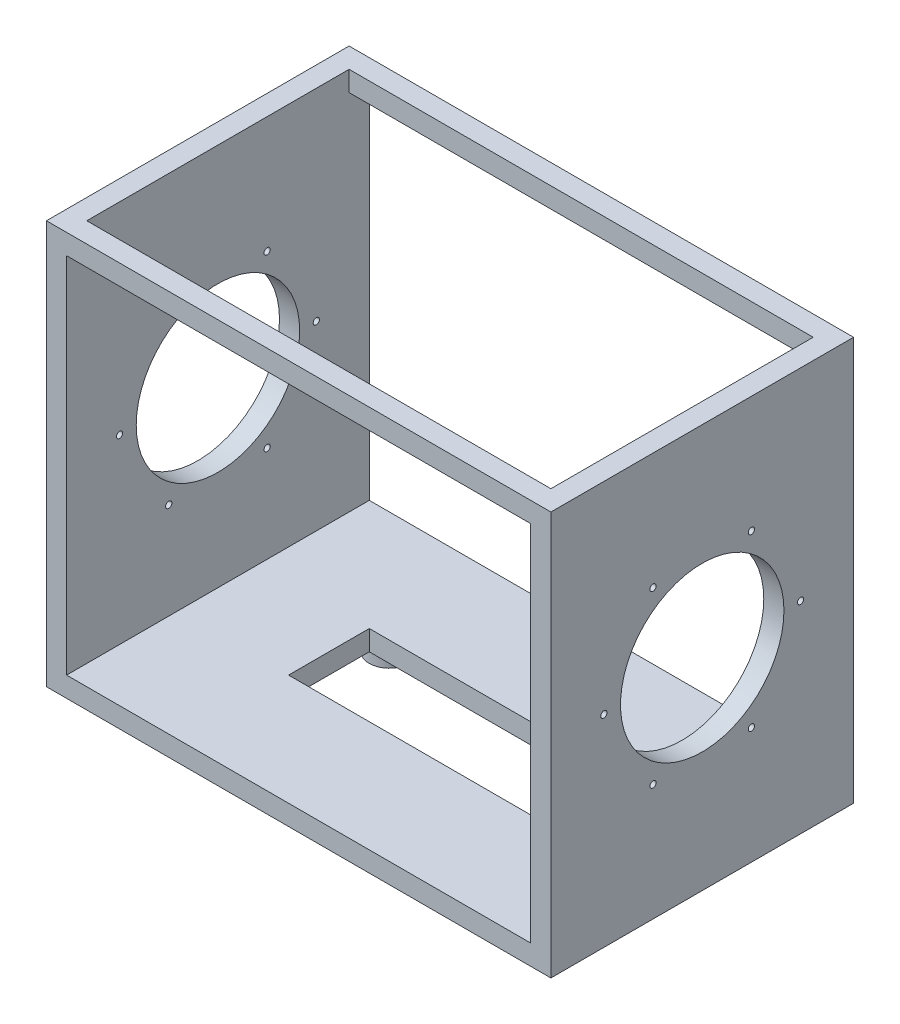
from build123d import *

# Parameters (mm, degrees)
SKETCH_1_W          = 250
SKETCH_1_H          = 150
EXTRUDE_2_DEPTH     = 200
SKETCH_3_W          = 230
SKETCH_3_H          = 130
CUT_EXTRUDE_1_DEPTH = 190
SKETCH_4_W          = 230
SKETCH_4_H          = 180
CUT_EXTRUDE_2_DEPTH = 190
SKETCH_5_R          = 40.5
SKETCH_5_R_2        = 1.55
CUT_EXTRUDE_3_DEPTH = 250
SKETCH_14_W         = 120
SKETCH_14_H         = 40
CUT_EXTRUDE_4_DEPTH = 20


with BuildPart() as part:
    # 草图1 → 凸台-拉伸2 (new body)
    with BuildSketch(Plane(origin=(0, 0, 0), x_dir=(1, 0, 0), z_dir=(0, 1, 0))):
        Rectangle(SKETCH_1_W, SKETCH_1_H)
    extrude(amount=EXTRUDE_2_DEPTH)

    # 草图3 → 切除-拉伸1 (cut)
    with BuildSketch(Plane(origin=(0, 200, 0), x_dir=(1, 0, 0), z_dir=(0, 1, 0))):
        Rectangle(SKETCH_3_W, SKETCH_3_H)
    extrude(amount=-CUT_EXTRUDE_1_DEPTH, mode=Mode.SUBTRACT)

    # 草图4 → 切除-拉伸2 (cut)
    with BuildSketch(Plane.XY.offset(75)):
        with Locations((0, 100)):
            Rectangle(SKETCH_4_W, SKETCH_4_H)
    extrude(amount=-CUT_EXTRUDE_2_DEPTH, mode=Mode.SUBTRACT)

    # 草图5 → 切除-拉伸3 (cut)
    with BuildSketch(Plane(origin=(125, 0, 0), x_dir=(0, 0, -1), z_dir=(1, 0, 0))):
        with Locations((0, 100)):
            Circle(SKETCH_5_R)
        with Locations((-24.375, 142.218738434)):
            Circle(SKETCH_5_R_2)
        with Locations((-48.75, 100)):
            Circle(SKETCH_5_R_2)
        with Locations((24.375, 142.218738434)):
            Circle(SKETCH_5_R_2)
        with Locations((48.75, 100)):
            Circle(SKETCH_5_R_2)
        with Locations((24.375, 57.781261566)):
            Circle(SKETCH_5_R_2)
        with Locations((-24.375, 57.781261566)):
            Circle(SKETCH_5_R_2)
    extrude(amount=-CUT_EXTRUDE_3_DEPTH, mode=Mode.SUBTRACT)

    # 草图10 → 旋转2 (revolve)
    with BuildSketch(Plane.XY.offset(45), mode=Mode.PRIVATE) as revolve_2_sk:
        Polygon((-75, 0), (-75, -20), (-85, -20), (-85, -10), (-95, 0), (-85, 0), align=None)
    revolve(revolve_2_sk.sketch.rotate(Axis((-75, 0, 45), (0, -1, 0)), 270), axis=Axis((-75, 0, 45), (0, -1, 0)))

    # 草图11 → 旋转4 (revolve)
    with BuildSketch(Plane.XY.offset(45), mode=Mode.PRIVATE) as revolve_4_sk:
        Polygon((75, 0), (55, 0), (65, -10), (65, -20), (75, -20), align=None)
    revolve(revolve_4_sk.sketch.rotate(Axis((75, 0, 45), (0, -1, 0)), 270), axis=Axis((75, 0, 45), (0, -1, 0)))

    # 草图12 → 旋转5 (revolve)
    with BuildSketch(Plane(origin=(0, 0, -45), x_dir=(-1, 0, 0), z_dir=(0, 0, -1)), mode=Mode.PRIVATE) as revolve_5_sk:
        Polygon((-75, 0), (-55, 0), (-65, -10), (-65, -20), (-75, -20), align=None)
    revolve(revolve_5_sk.sketch.rotate(Axis((75, 0, -45), (0, -1, 0)), 270), axis=Axis((75, 0, -45), (0, -1, 0)))

    # 草图13 → 旋转6 (revolve)
    with BuildSketch(Plane(origin=(0, 0, -45), x_dir=(-1, 0, 0), z_dir=(0, 0, -1)), mode=Mode.PRIVATE) as revolve_6_sk:
        Polygon((75, 0), (55, 0), (65, -10), (65, -20), (75, -20), align=None)
    revolve(revolve_6_sk.sketch.rotate(Axis((-75, 0, -45), (0, -1, 0)), 90), axis=Axis((-75, 0, -45), (0, -1, 0)))

    # 草图14 → 切除-拉伸4 (cut)
    with BuildSketch(Plane(origin=(0, 10, 0), x_dir=(1, 0, 0), z_dir=(0, 1, 0))):
        Rectangle(SKETCH_14_W, SKETCH_14_H)
    extrude(amount=-CUT_EXTRUDE_4_DEPTH, mode=Mode.SUBTRACT)


solid = part.part
